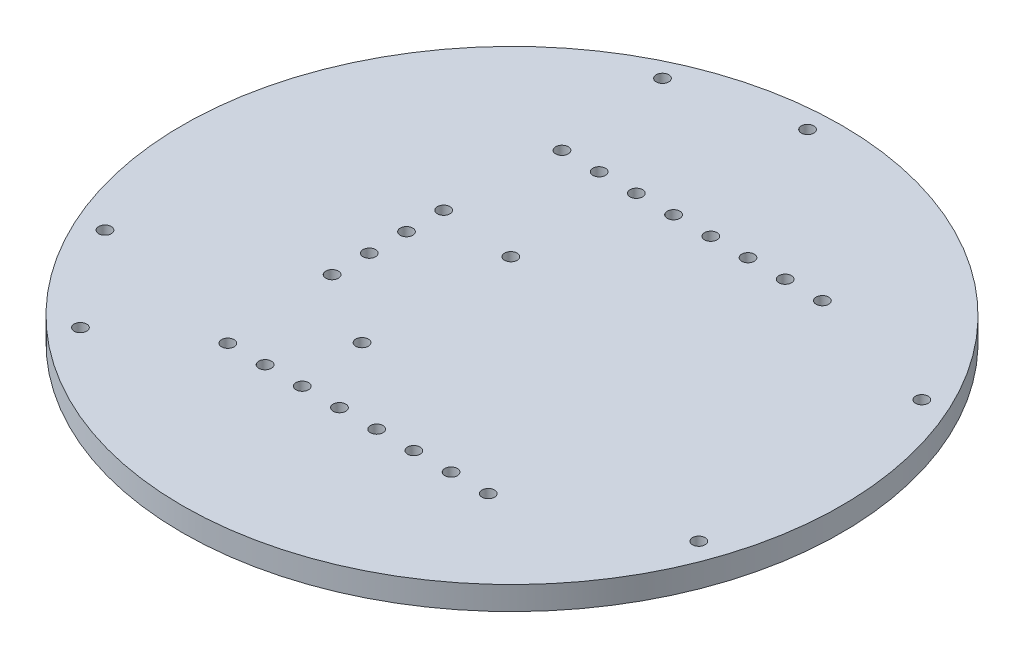
from build123d import *

# Parameters (mm, degrees)
SKETCH1_R           = 22.5
BOSS_EXTRUDE1_DEPTH = 1.6
SKETCH2_R           = 0.429187569
CUT_EXTRUDE1_DEPTH  = 32.860006277


with BuildPart() as part:
    # Sketch1 → Boss-Extrude1 (new body)
    with BuildSketch(Plane(origin=(0, 0, 0), x_dir=(1, 0, 0), z_dir=(0, 1, 0))):
        with Locations(Location((0, 0, 0), (0, 0, 270))):
            Circle(SKETCH1_R)
    extrude(amount=BOSS_EXTRUDE1_DEPTH)

    # Sketch2 → Cut-Extrude1 (cut, through all)
    with BuildSketch(Plane.XZ):
        with Locations(Location((9.721005352, 11.34055894, 0), (0, 0, 270))):
            Circle(SKETCH2_R)
        with Locations(Location((7.181005352, 11.34055894, 0), (0, 0, 270))):
            Circle(SKETCH2_R)
        with Locations(Location((4.641005352, 11.34055894, 0), (0, 0, 270))):
            Circle(SKETCH2_R)
        with Locations(Location((2.101005352, 11.34055894, 0), (0, 0, 270))):
            Circle(SKETCH2_R)
        with Locations(Location((-0.438994648, 11.34055894, 0), (0, 0, 270))):
            Circle(SKETCH2_R)
        with Locations(Location((-2.978994648, 11.34055894, 0), (0, 0, 270))):
            Circle(SKETCH2_R)
        with Locations(Location((-5.518994648, 11.34055894, 0), (0, 0, 270))):
            Circle(SKETCH2_R)
        with Locations(Location((-8.058994648, 11.34055894, 0), (0, 0, 270))):
            Circle(SKETCH2_R)
        with Locations(Location((9.721005352, -11.469960564, 0), (0, 0, 270))):
            Circle(SKETCH2_R)
        with Locations(Location((7.181005352, -11.469960564, 0), (0, 0, 270))):
            Circle(SKETCH2_R)
        with Locations(Location((4.641005352, -11.469960564, 0), (0, 0, 270))):
            Circle(SKETCH2_R)
        with Locations(Location((2.101005352, -11.469960564, 0), (0, 0, 270))):
            Circle(SKETCH2_R)
        with Locations(Location((-0.438994648, -11.469960564, 0), (0, 0, 270))):
            Circle(SKETCH2_R)
        with Locations(Location((-2.978994648, -11.469960564, 0), (0, 0, 270))):
            Circle(SKETCH2_R)
        with Locations(Location((-5.518994648, -11.469960564, 0), (0, 0, 270))):
            Circle(SKETCH2_R)
        with Locations(Location((-8.058994648, -11.469960564, 0), (0, 0, 270))):
            Circle(SKETCH2_R)
        with Locations(Location((-8.554850814, 3.728315564, 0), (0, 0, 270))):
            Circle(SKETCH2_R)
        with Locations(Location((-8.554850814, 1.188315564, 0), (0, 0, 270))):
            Circle(SKETCH2_R)
        with Locations(Location((-8.554850814, -1.351684436, 0), (0, 0, 270))):
            Circle(SKETCH2_R)
        with Locations(Location((-8.554850814, -3.891684436, 0), (0, 0, 270))):
            Circle(SKETCH2_R)
        with Locations(Location((-3.513785175, 6.72628012, 0), (0, 0, 270))):
            Circle(SKETCH2_R)
        with Locations(Location((-14.013865652, 15.451077266, 0), (0, 0, 270))):
            Circle(SKETCH2_R)
        with Locations(Location((-18.940700894, 8.847549383, 0), (0, 0, 270))):
            Circle(SKETCH2_R)
        with Locations(Location((-3.513785175, -3.436577571, 0), (0, 0, 270))):
            Circle(SKETCH2_R)
        with Locations(Location((-8.884144238, -19.158046189, 0), (0, 0, 270))):
            Circle(SKETCH2_R)
        with Locations(Location((-0.906931184, -21.088850712, 0), (0, 0, 270))):
            Circle(SKETCH2_R)
        with Locations(Location((19.722815894, 6.970464171, 0), (0, 0, 270))):
            Circle(SKETCH2_R)
        with Locations(Location((18.971783185, -9.009472345, 0), (0, 0, 270))):
            Circle(SKETCH2_R)
    extrude(amount=-CUT_EXTRUDE1_DEPTH, mode=Mode.SUBTRACT)


solid = part.part
